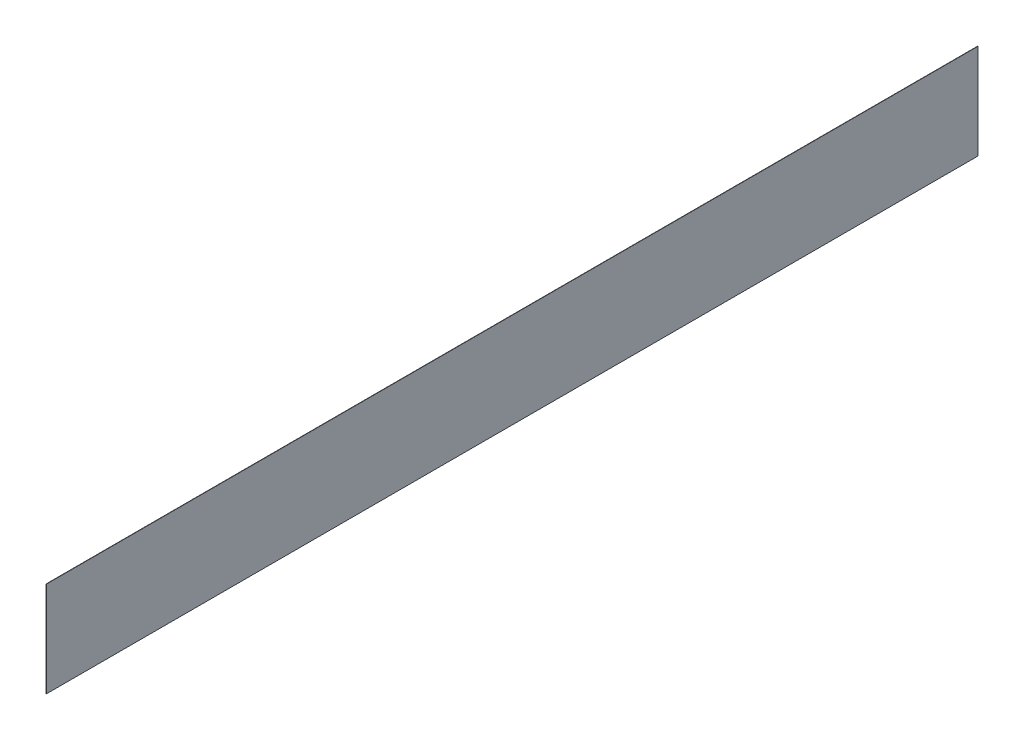
from build123d import *

# Parameters (mm, degrees)
SKETCH1_W           = 550
SKETCH1_H           = 300
SKETCH1_W_2         = 720
SKETCH1_W_3         = 100
BOSS_EXTRUDE1_DEPTH = 1


with BuildPart() as part:
    # Sketch1 → Boss-Extrude1 (new body)
    with BuildSketch(Plane(origin=(0, 0, 0), x_dir=(0, 0, -1), z_dir=(1, 0, 0))):
        with Locations((275, -150)):
            Rectangle(SKETCH1_W, SKETCH1_H)
        with Locations((1010, -150)):
            Rectangle(SKETCH1_W_2, SKETCH1_H)
        with Locations((600, -150)):
            Rectangle(SKETCH1_W_3, SKETCH1_H)
        with Locations((1420, -150)):
            Rectangle(SKETCH1_W_3, SKETCH1_H)
        with Locations((1745, -150)):
            Rectangle(SKETCH1_W, SKETCH1_H)
        with Locations((2070, -150)):
            Rectangle(SKETCH1_W_3, SKETCH1_H)
        with Locations((2480, -150)):
            Rectangle(SKETCH1_W_2, SKETCH1_H)
        with Locations((2890, -150)):
            Rectangle(SKETCH1_W_3, SKETCH1_H)
    extrude(amount=-BOSS_EXTRUDE1_DEPTH)


solid = part.part
